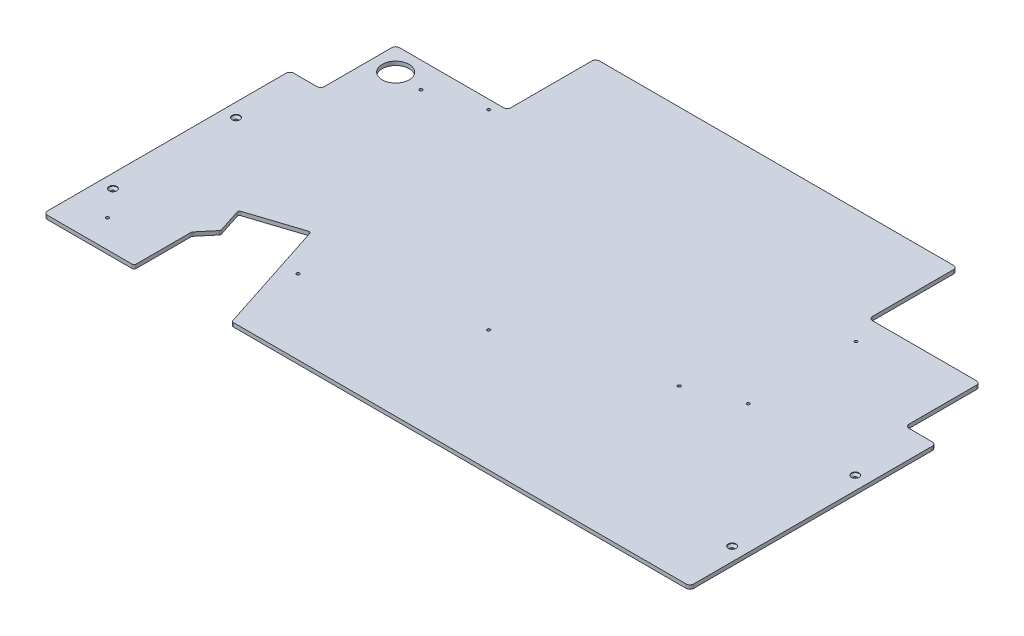
from build123d import *

# Parameters (mm, degrees)
SKETCH1_R                                     = 3.3734375
BOSS_EXTRUDE1_DEPTH                           = 6.35
SKETCH3_R                                     = 2.45745
SKETCH3_R_2                                   = 22.225
CUT_EXTRUDE2_DEPTH                            = 1264.111411604
CUT_EXTRUDE1_DEPTH                            = 1264.111411604
CSK_FOR_1_4_FLAT_HEAD_MACHINE_SCREW1_AT_COUNT = 2
CSK_FOR_1_4_FLAT_HEAD_MACHINE_SCREW1_AT_PITCH = 1022.35
CSK_FOR_1_4_FLAT_HEAD_MACHINE_SCREW1_2_COUNT  = 2
CSK_FOR_1_4_FLAT_HEAD_MACHINE_SCREW1_2_PITCH  = 203.2
CSK_FOR_1_4_FLAT_HEAD_MACHINE_SCREW1_3_COUNT  = 2
CSK_FOR_1_4_FLAT_HEAD_MACHINE_SCREW1_3_PITCH  = 1042.348196382
FILLET1_R                                     = 6.35
FILLET3_R                                     = 3.175


with BuildPart() as part:
    # Sketch1 → Boss-Extrude1 (new body)
    with BuildSketch(Plane(origin=(0, 0, 0), x_dir=(1, 0, 0), z_dir=(0, 1, 0))):
        Polygon((1016, 406.4), (1066.8, 406.4), (1066.8, 0), (0, 0), (0, 406.4), (50.8, 406.4), (50.8, 530.225), (234.95, 530.225), (234.95, 676.275), (831.85, 676.275), (831.85, 530.225), (1016, 530.225), align=None)
        with Locations(Location((22.225, 92.075, 0), (0, 0, 270))):
            Circle(SKETCH1_R, mode=Mode.SUBTRACT)
        with Locations(Location((1044.575, 92.075, 0), (0, 0, 270))):
            Circle(SKETCH1_R, mode=Mode.SUBTRACT)
        with Locations(Location((22.225, 295.275, 0), (0, 0, 270))):
            Circle(SKETCH1_R, mode=Mode.SUBTRACT)
        with Locations(Location((1044.575, 295.275, 0), (0, 0, 270))):
            Circle(SKETCH1_R, mode=Mode.SUBTRACT)
    extrude(amount=BOSS_EXTRUDE1_DEPTH)

    # Sketch3 → Cut-Extrude2 (cut, through all)
    with BuildSketch(Plane(origin=(0, 6.35, 0), x_dir=(1, 0, 0), z_dir=(0, 1, 0))):
        with Locations(Location((134.9375, 487.748914195, 0), (0, 0, 270))):
            Circle(SKETCH3_R)
        with Locations(Location((219.486424299, 515.220524995, 0), (0, 0, 270))):
            Circle(SKETCH3_R)
        with Locations(Location((59.31154, 45.87748, 0), (0, 0, 270))):
            Circle(SKETCH3_R)
        with Locations(Location((296.845703608, 123.057008284, 0), (0, 0, 270))):
            Circle(SKETCH3_R)
        with Locations(Location((534.379867216, 200.236536569, 0), (0, 0, 270))):
            Circle(SKETCH3_R)
        with Locations(Location((771.914030824, 277.416064853, 0), (0, 0, 270))):
            Circle(SKETCH3_R)
        with Locations(Location((854.075, 309.0545, 0), (0, 0, 270))):
            Circle(SKETCH3_R)
        with Locations(Location((854.075, 486.8545, 0), (0, 0, 270))):
            Circle(SKETCH3_R)
        with Locations(Location((88.9, 492.125, 0), (0, 0, 270))):
            Circle(SKETCH3_R_2)
    extrude(amount=-CUT_EXTRUDE2_DEPTH, mode=Mode.SUBTRACT)

    # Sketch2 → Cut-Extrude1 (cut, through all)
    with BuildSketch(Plane(origin=(0, 6.35, 0), x_dir=(1, 0, 0), z_dir=(0, 1, 0))):
        Polygon((310.578822168, 0), (149.225, 0), (149.225, 95.25), (171.033618902, 121.240499926), (157.061866823, 164.241131286), (247.65, 193.675), align=None)
    extrude(amount=-CUT_EXTRUDE1_DEPTH, mode=Mode.SUBTRACT)

    # Sketch5 → CSK for 1/4 Flat Head Machine Screw1 (revolve, cut)
    with BuildSketch(Plane(origin=(22.225, 6.35, -92.075), x_dir=(0, 0, 1), z_dir=(1, 0, 0))):
        Polygon((0, 0), (0, 6.35), (3.3782, 6.35), (3.3782, 4.536932584), (6.4389, 1.016), (6.4389, 0), align=None)
    csk_for_1_4_flat_head_machine_screw1 = revolve(axis=Axis((22.225, 12.7, -92.075), (0, -1, 0)), mode=Mode.SUBTRACT)

    # CSK for 1/4 Flat Head Machine Screw1 at: CSK for 1/4 Flat Head Machine Screw1 ×2
    with Locations(*[(i * CSK_FOR_1_4_FLAT_HEAD_MACHINE_SCREW1_AT_PITCH, 0, 0) for i in range(1, CSK_FOR_1_4_FLAT_HEAD_MACHINE_SCREW1_AT_COUNT)]):
        add(csk_for_1_4_flat_head_machine_screw1, mode=Mode.SUBTRACT)

    # CSK for 1_4 Flat Head Machine Screw1 2: CSK for 1/4 Flat Head Machine Screw1 ×2
    with Locations(*[(0, 0, -i * CSK_FOR_1_4_FLAT_HEAD_MACHINE_SCREW1_2_PITCH) for i in range(1, CSK_FOR_1_4_FLAT_HEAD_MACHINE_SCREW1_2_COUNT)]):
        add(csk_for_1_4_flat_head_machine_screw1, mode=Mode.SUBTRACT)

    # CSK for 1_4 Flat Head Machine Screw1 3: CSK for 1/4 Flat Head Machine Screw1 ×2
    with Locations(*[Vector(0.9808142840837317, 0, -0.19494445397937524) * (i * CSK_FOR_1_4_FLAT_HEAD_MACHINE_SCREW1_3_PITCH) for i in range(1, CSK_FOR_1_4_FLAT_HEAD_MACHINE_SCREW1_3_COUNT)]):
        add(csk_for_1_4_flat_head_machine_screw1, mode=Mode.SUBTRACT)

    # Fillet1
    fillet1_edges = [part.edges().sort_by_distance(p)[0] for p in [
        (0, 3.175, -406.4),
        (50.8, 3.175, -406.4),
        (50.8, 3.175, -530.225),
        (234.95, 3.175, -530.225),
        (234.95, 3.175, -676.275),
        (831.85, 3.175, -676.275),
        (831.85, 3.175, -530.225),
        (1016, 3.175, -530.225),
        (1016, 3.175, -406.4),
        (1066.8, 3.175, -406.4),
        (1066.8, 3.175, 0),
        (0, 3.175, 0),
    ]]
    fillet(fillet1_edges, radius=FILLET1_R)

    # Fillet3
    fillet3_edges = [part.edges().sort_by_distance(p)[0] for p in [
        (247.65, 3.175, -193.675),
        (310.578822168, 3.175, 0),
        (149.225, 3.175, 0),
        (149.225, 3.175, -95.25),
        (171.033618902, 3.175, -121.240499926),
        (157.061866823, 3.175, -164.241131286),
    ]]
    fillet(fillet3_edges, radius=FILLET3_R)


solid = part.part
